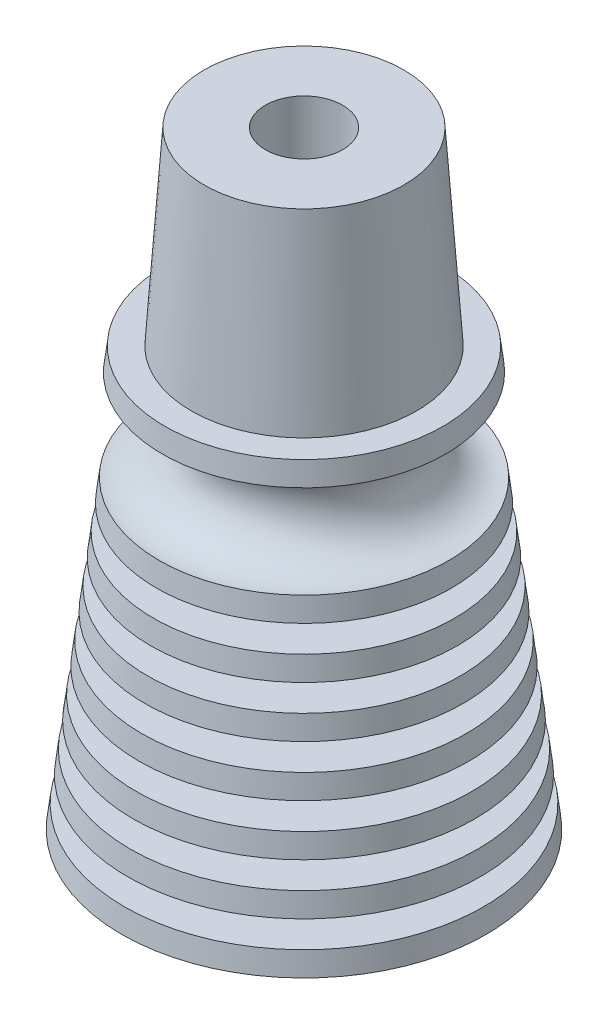
from build123d import *

# Parameters (mm, degrees)
SKETCH2_R          = 1.9177
CUT_EXTRUDE1_DEPTH = 33.764861657


with BuildPart() as part:
    # Sketch1 → Revolve1 (revolve)
    with BuildSketch(Plane.XY, mode=Mode.PRIVATE) as revolve1_sk:
        with BuildLine():
            Line((0, 0), (0, 30.1625))
            Line((0, 30.1625), (4.953, 30.1625))
            Line((4.953, 30.1625), (5.588, 20.76733075))
            Line((5.588, 20.76733075), (6.904482, 20.76733075))
            Line((6.904482, 20.76733075), (7.04215, 19.64973075))
            ThreePointArc((7.04215, 19.64973075), (4.64185, 17.316376969), (7.183974364, 15.1384))
            Line((7.183974364, 15.1384), (7.321642364, 14.0208))
            Line((7.321642364, 14.0208), (4.622892364, 14.0208))
            Line((4.622892364, 14.0208), (4.773075636, 12.8016))
            Line((4.773075636, 12.8016), (7.471825636, 12.8016))
            Line((7.471825636, 12.8016), (7.609493636, 11.684))
            Line((7.609493636, 11.684), (4.910743636, 11.684))
            Line((4.910743636, 11.684), (5.060926909, 10.4648))
            Line((5.060926909, 10.4648), (7.759676909, 10.4648))
            Line((7.759676909, 10.4648), (7.897344909, 9.3472))
            Line((7.897344909, 9.3472), (5.198594909, 9.3472))
            Line((5.198594909, 9.3472), (5.348778182, 8.128))
            Line((5.348778182, 8.128), (8.047528182, 8.128))
            Line((8.047528182, 8.128), (8.185196182, 7.0104))
            Line((8.185196182, 7.0104), (5.486446182, 7.0104))
            Line((5.486446182, 7.0104), (5.636629455, 5.7912))
            Line((5.636629455, 5.7912), (8.335379455, 5.7912))
            Line((8.335379455, 5.7912), (8.473047455, 4.6736))
            Line((8.473047455, 4.6736), (5.774297455, 4.6736))
            Line((5.774297455, 4.6736), (5.924480727, 3.4544))
            Line((5.924480727, 3.4544), (8.623230727, 3.4544))
            Line((8.623230727, 3.4544), (8.760898727, 2.3368))
            Line((8.760898727, 2.3368), (6.062148727, 2.3368))
            Line((6.062148727, 2.3368), (6.212332, 1.1176))
            Line((6.212332, 1.1176), (8.911082, 1.1176))
            Line((8.911082, 1.1176), (9.04875, 0))
            Line((9.04875, 0), (0, 0))
        make_face()
    revolve(revolve1_sk.sketch.rotate(Axis((0, 0, 0), (0, 1, 0)), 90), axis=Axis((0, 0, 0), (0, 1, 0)))

    # Sketch2 → Cut-Extrude1 (cut, through all)
    with BuildSketch(Plane(origin=(0, 30.1625, 0), x_dir=(1, 0, 0), z_dir=(0, 1, 0))):
        with Locations(Location((0, 0, 0), (0, 0, 270))):
            Circle(SKETCH2_R)
    extrude(amount=-CUT_EXTRUDE1_DEPTH, mode=Mode.SUBTRACT)


solid = part.part
